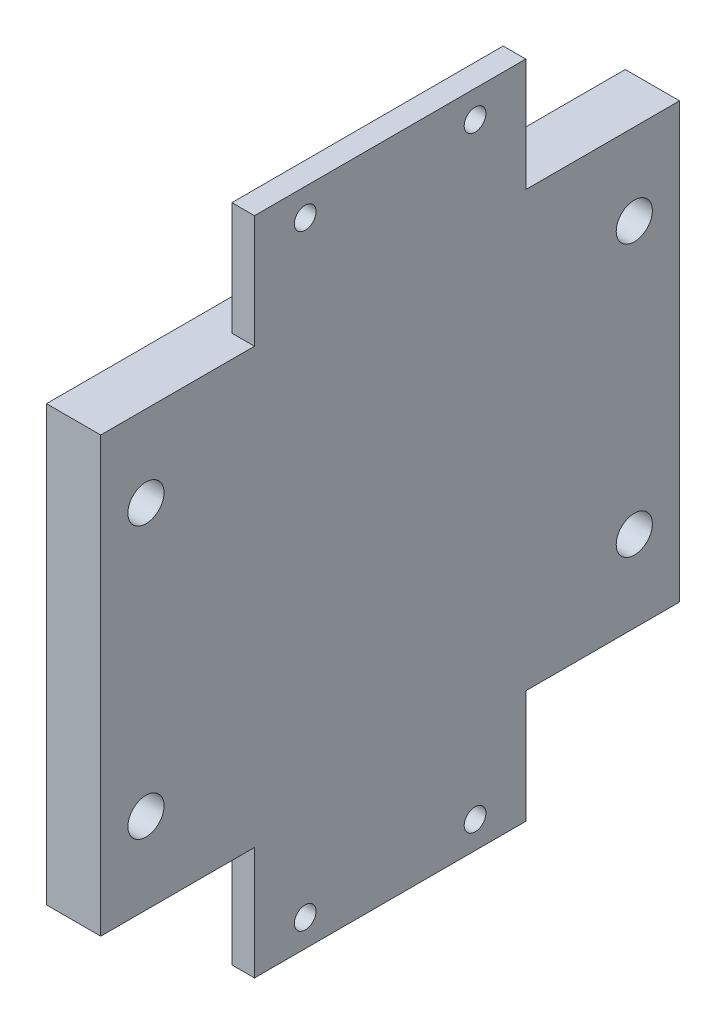
from build123d import *

# Parameters (mm, degrees)
SKETCH_1_W          = 32
SKETCH_1_H          = 24
EXTRUDE_1_DEPTH     = 3
SKETCH_4_W          = 6.4
SKETCH_4_H          = 24
CUT_EXTRUDE_1_DEPTH = 1.75
SKETCH_5_W          = 1.250005523
SKETCH_5_H          = 15
EXTRUDE_2_DEPTH     = 6.25
EXTRUDE_START       = -24
SKETCH_5_2_W        = 1.250005523
SKETCH_5_2_H        = 15
EXTRUDE_3_DEPTH     = 6.25
SKETCH_6_R          = 0.6
CUT_EXTRUDE_2_DEPTH = 25.455316395
SKETCH_7_R          = 1.75
SKETCH_7_R_2        = 1
CUT_EXTRUDE_4_DEPTH = 1.5
SKETCH_7_2_R        = 1
CUT_EXTRUDE_5_DEPTH = 25.455316395


with BuildPart() as part:
    # 草图1 → 凸台-拉伸1 (new body)
    with BuildSketch(Plane(origin=(0, 0, 0), x_dir=(0, 0, -1), z_dir=(1, 0, 0))):
        Rectangle(SKETCH_1_W, SKETCH_1_H)
    extrude(amount=EXTRUDE_1_DEPTH)

    # 草图4 → 切除-拉伸1 (cut)
    with BuildSketch(Plane.ZY):
        Rectangle(SKETCH_4_W, SKETCH_4_H)
    extrude(amount=-CUT_EXTRUDE_1_DEPTH, mode=Mode.SUBTRACT)

    # 草图5 → 凸台-拉伸2 (add)
    with BuildSketch(Plane.XZ.offset(12)):
        with Locations((2.374997239, 0)):
            Rectangle(SKETCH_5_W, SKETCH_5_H)
    extrude(amount=EXTRUDE_2_DEPTH)

    # 草图5<2> → 凸台-拉伸3 (add)
    with BuildSketch(Plane.XZ.offset(12).offset(EXTRUDE_START)):
        with Locations((2.374997239, 0)):
            Rectangle(SKETCH_5_2_W, SKETCH_5_2_H)
    extrude(amount=-EXTRUDE_3_DEPTH)

    # 草图6 → 切除-拉伸2 (cut, through all)
    with BuildSketch(Plane(origin=(3, 0, 0), x_dir=(0, 0, -1), z_dir=(1, 0, 0))):
        with Locations((4.695742753, -16.75)):
            Circle(SKETCH_6_R)
        with Locations((-4.695742753, -16.75)):
            Circle(SKETCH_6_R)
        with Locations((4.695742753, 16.75)):
            Circle(SKETCH_6_R)
        with Locations((-4.695742753, 16.75)):
            Circle(SKETCH_6_R)
    extrude(amount=-CUT_EXTRUDE_2_DEPTH, mode=Mode.SUBTRACT)

    # 草图7 → 切除-拉伸4 (cut)
    # profile 1 of 4: a face of its own
    with BuildSketch(Plane.ZY):
        with Locations((13.5, 7.5)):
            Circle(SKETCH_7_R)
        with Locations((13.5, 7.5)):
            Circle(SKETCH_7_R_2, mode=Mode.SUBTRACT)
    # profile 2 of 4: a face of its own
    with BuildSketch(Plane.ZY):
        with Locations((13.5, -7.5)):
            Circle(SKETCH_7_R)
        with Locations((13.5, -7.5)):
            Circle(SKETCH_7_R_2, mode=Mode.SUBTRACT)
    # profile 3 of 4: a face of its own
    with BuildSketch(Plane.ZY):
        with Locations((-13.5, 7.5)):
            Circle(SKETCH_7_R)
        with Locations((-13.5, 7.5)):
            Circle(SKETCH_7_R_2, mode=Mode.SUBTRACT)
    # profile 4 of 4: a face of its own
    with BuildSketch(Plane.ZY):
        with Locations((-13.5, -7.5)):
            Circle(SKETCH_7_R)
        with Locations((-13.5, -7.5)):
            Circle(SKETCH_7_R_2, mode=Mode.SUBTRACT)
    extrude(amount=-CUT_EXTRUDE_4_DEPTH, mode=Mode.SUBTRACT)

    # 草图7<2> → 切除-拉伸5 (cut, through all)
    with BuildSketch(Plane.ZY):
        with Locations((13.5, 7.5)):
            Circle(SKETCH_7_2_R)
        with Locations((13.5, -7.5)):
            Circle(SKETCH_7_2_R)
        with Locations((-13.5, -7.5)):
            Circle(SKETCH_7_2_R)
        with Locations((-13.5, 7.5)):
            Circle(SKETCH_7_2_R)
    extrude(amount=-CUT_EXTRUDE_5_DEPTH, mode=Mode.SUBTRACT)


solid = part.part
